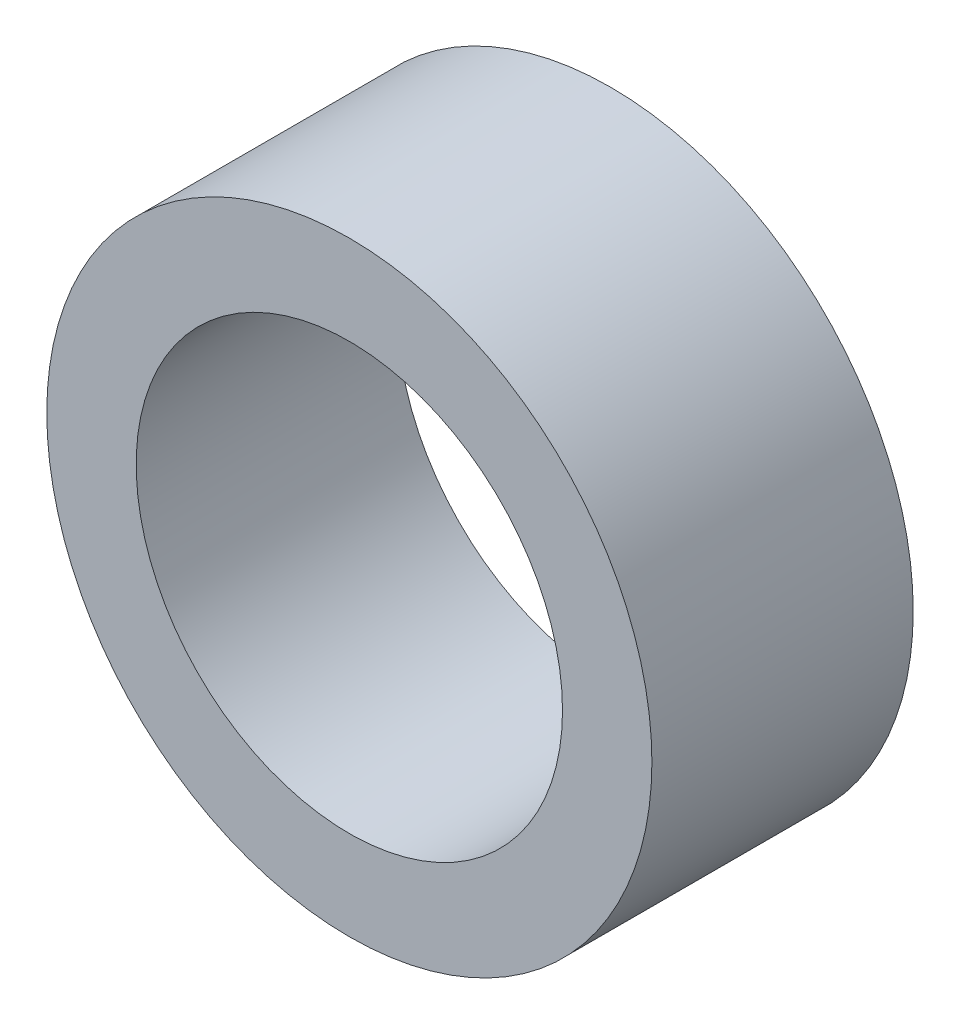
from build123d import *

# Parameters (mm, degrees)
BEARING_START                              = 23
SKETCH1_R                                  = 22
SKETCH1_R_2                                = 15.5
BEARING_ENVELOPE_31_MM_ID_X_44_MM_OD_DEPTH = 19


with BuildPart() as part:
    # Sketch1 → Bearing envelope - 31 mm ID x 44 mm OD (new body)
    with BuildSketch(Plane.XY.offset(BEARING_START)):
        Circle(SKETCH1_R)
        Circle(SKETCH1_R_2, mode=Mode.SUBTRACT)
    extrude(amount=BEARING_ENVELOPE_31_MM_ID_X_44_MM_OD_DEPTH)


solid = part.part
